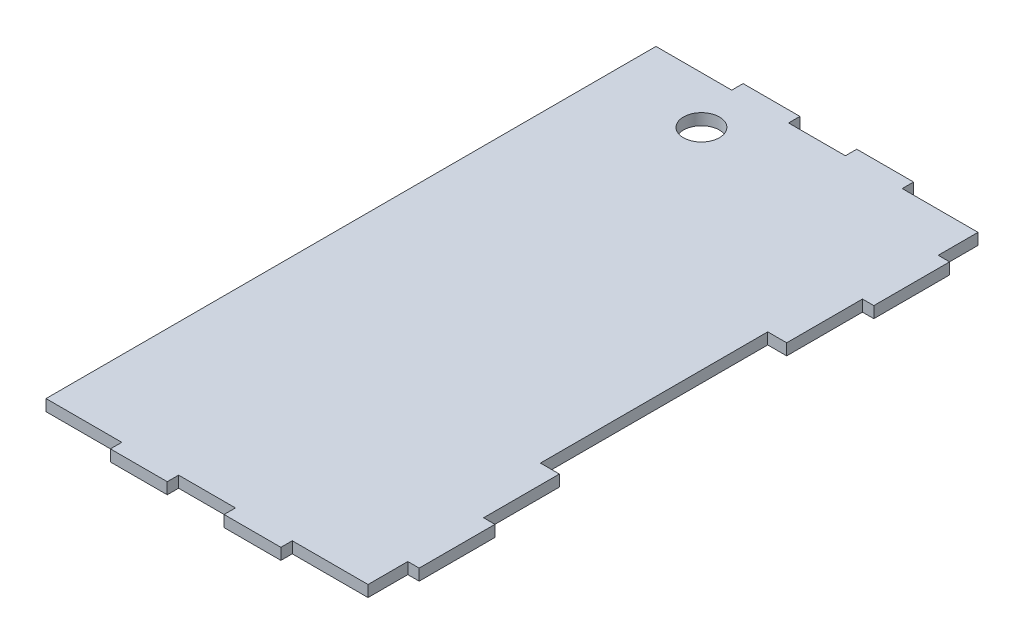
from build123d import *

# Parameters (mm, degrees)
CROQUIS1_R              = 4.75
SALIENTE_EXTRUIR1_DEPTH = 3


with BuildPart() as part:
    # Croquis1 → Saliente-Extruir1 (new body)
    with BuildSketch(Plane(origin=(0, 0, 0), x_dir=(1, 0, 0), z_dir=(0, 1, 0))):
        Polygon((25.5, 2.5), (25.5, -0.5), (40.5, -0.5), (40.5, 2.5), (55.5, 2.5), (55.5, -0.5), (70.5, -0.5), (70.5, 2.5), (90.5, 2.5), (90.5, 13), (93.5, 13), (93.5, 33), (90.5, 33), (90.5, 53), (85.5, 53), (85.5, 113), (90.5, 113), (90.5, 133), (93.5, 133), (93.5, 153), (90.5, 153), (90.5, 163.5), (70.5, 163.5), (70.5, 166.5), (55.5, 166.5), (55.5, 163.5), (40.5, 163.5), (40.5, 166.5), (25.5, 166.5), (25.5, 163.5), (5.5, 163.5), (5.5, 153), (5.5, 133), (5.5, 113), (5.5, 93), (5.5, 73), (5.5, 53), (5.5, 33), (5.5, 13), (5.5, 2.5), align=None)
        with Locations(Location((30, 151, 0), (0, 0, 270))):
            Circle(CROQUIS1_R, mode=Mode.SUBTRACT)
    extrude(amount=SALIENTE_EXTRUIR1_DEPTH)


solid = part.part
